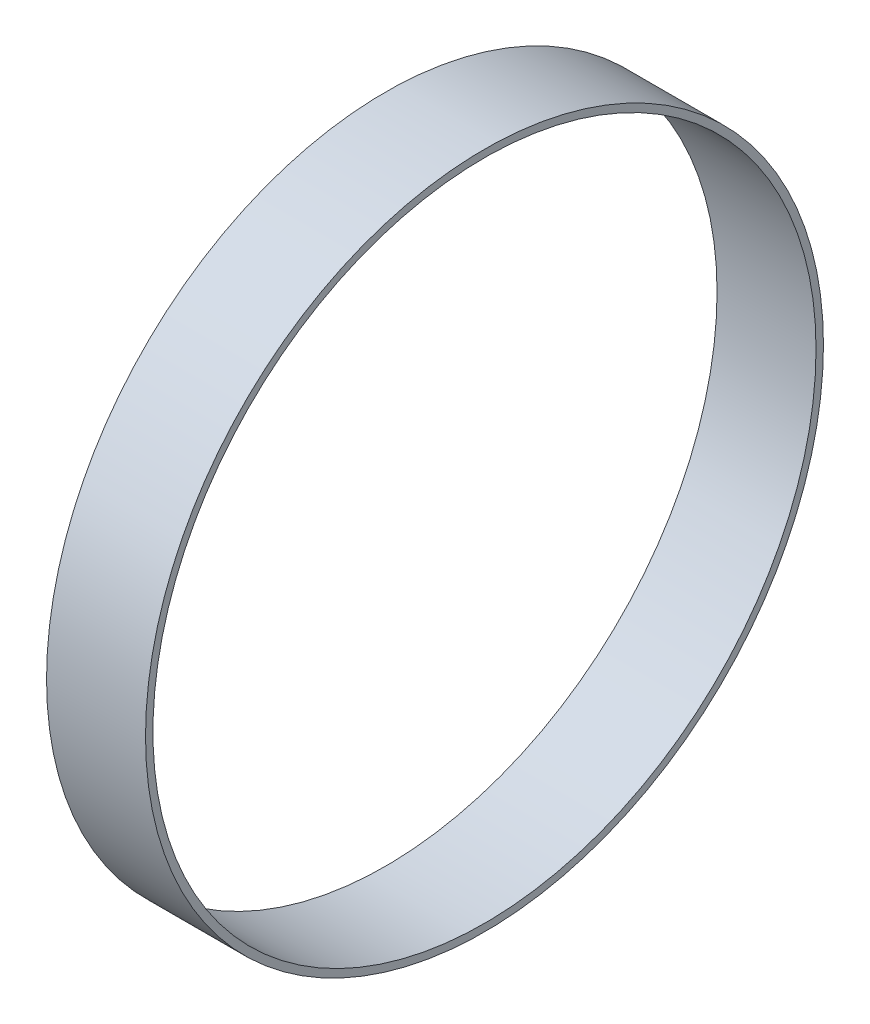
from build123d import *

# Parameters (mm, degrees)
SKETCH1_R           = 86.995
SKETCH1_R_2         = 85.09
BOSS_EXTRUDE1_DEPTH = 25.4


with BuildPart() as part:
    # Sketch1 → Boss-Extrude1 (new body)
    with BuildSketch(Plane.YZ):
        with Locations(Location((0, 0, 0), (0, 0, 270))):
            Circle(SKETCH1_R)
        with Locations(Location((0, 0, 0), (0, 0, 270))):
            Circle(SKETCH1_R_2, mode=Mode.SUBTRACT)
    extrude(amount=BOSS_EXTRUDE1_DEPTH)


solid = part.part
